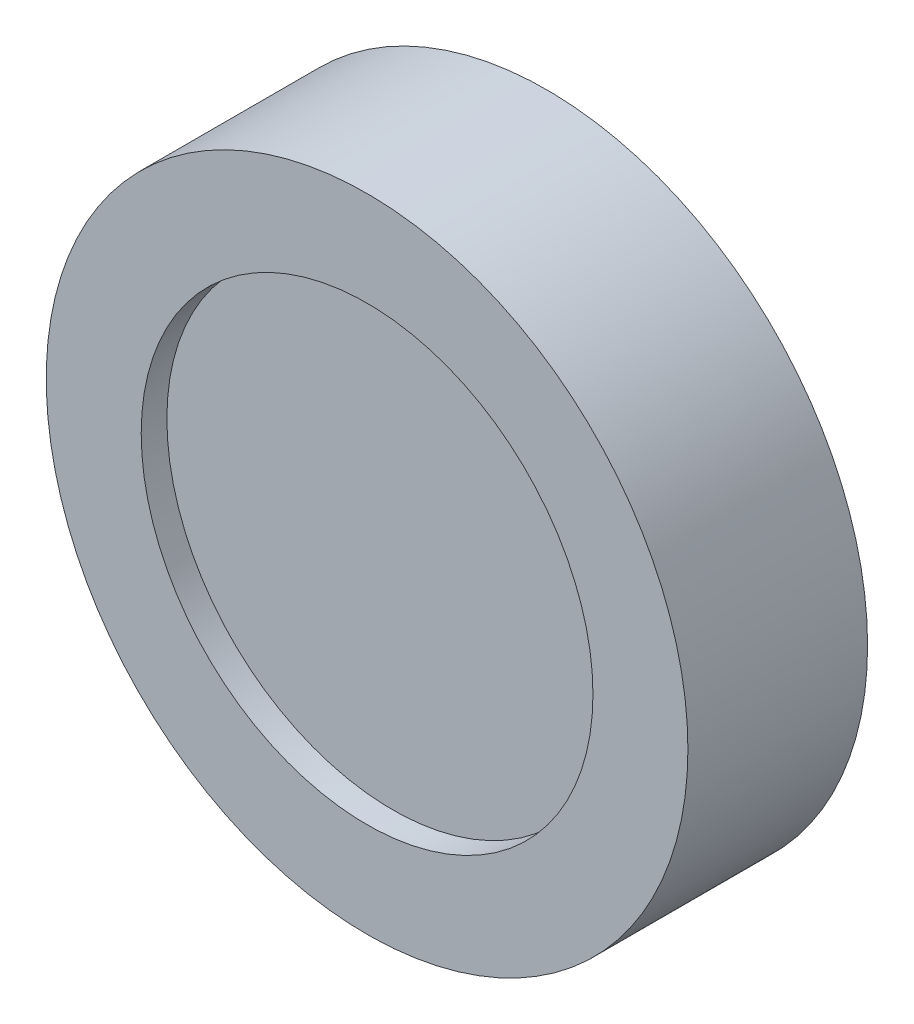
from build123d import *

# Parameters (mm, degrees)
SKETCH1_R           = 6.25
BOSS_EXTRUDE1_DEPTH = 3.5
SKETCH2_R           = 4.4
CUT_EXTRUDE1_DEPTH  = 0.5


with BuildPart() as part:
    # Sketch1 → Boss-Extrude1 (new body)
    with BuildSketch(Plane.XY):
        Circle(SKETCH1_R)
    extrude(amount=BOSS_EXTRUDE1_DEPTH)

    # Sketch2 → Cut-Extrude1 (cut)
    with BuildSketch(Plane.XY.offset(3.5)):
        Circle(SKETCH2_R)
    cut_extrude1 = extrude(amount=-CUT_EXTRUDE1_DEPTH, mode=Mode.SUBTRACT)

    # Mirror1: Cut-Extrude1 across plane
    add(cut_extrude1.mirror(Plane.XY.offset(1.75)), mode=Mode.SUBTRACT)


solid = part.part
